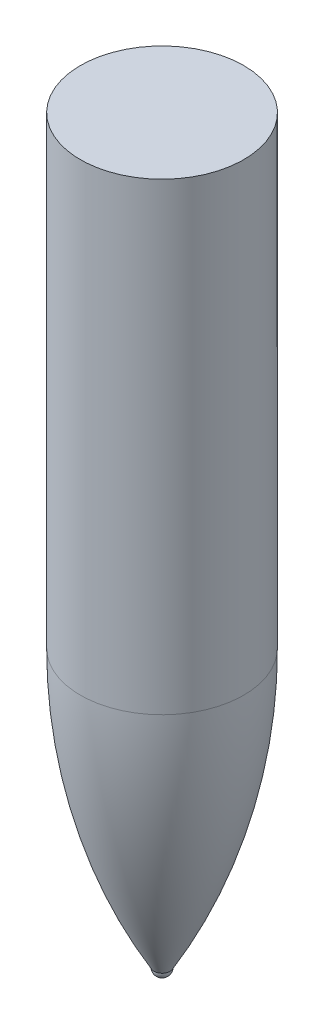
from build123d import *


with BuildPart() as part:
    # Sketch1 → Revolve1 (revolve)
    with BuildSketch(Plane.XY, mode=Mode.PRIVATE) as revolve1_sk:
        with BuildLine():
            Line((-2.5, 22.9), (-2.5, 8.695399038))
            ThreePointArc((-2.5, 8.695399038), (-1.925921675, 4.321009866), (-0.242566361, 0.242877764))
            ThreePointArc((-0.242566361, 0.242877764), (-0.171630452, 0.071156163), (0, 0))
            Line((0, 0), (0, 22.9))
            Line((0, 22.9), (-2.5, 22.9))
        make_face()
    revolve(revolve1_sk.sketch.rotate(Axis((0, 0, 0), (0, 1, 0)), 270), axis=Axis((0, 0, 0), (0, 1, 0)))


solid = part.part
